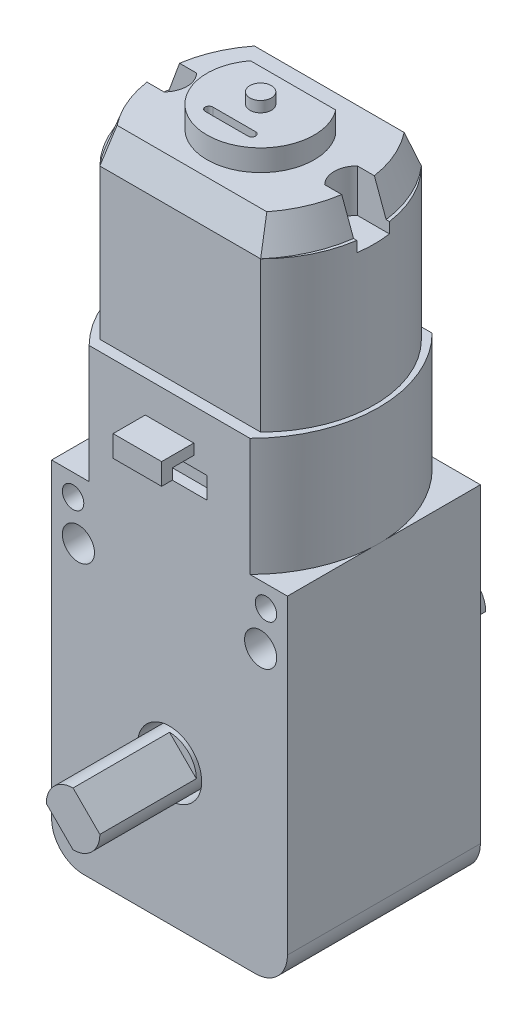
from build123d import *

# Parameters (mm, degrees)
EXTRUDE_1_DEPTH      = 18
EXTRUDE_2_DEPTH      = 11
SKETCH_3_R           = 1
SKETCH_3_R_2         = 1.5
CUT_EXTRUDE_1_DEPTH  = 31
SKETCH_4_R           = 3
CUT_EXTRUDE_2_DEPTH  = 7
CUT_EXTRUDE_START    = -7
SKETCH_5_R           = 3
CUT_EXTRUDE_3_DEPTH  = 7
SKETCH_6_R           = 2.5
EXTRUDE_3_DEPTH      = 16
CUT_EXTRUDE_START_2  = -9
CUT_EXTRUDE_4_DEPTH  = 9
EXTRUDE_START        = 16
SKETCH_8_R           = 2.5
EXTRUDE_4_DEPTH      = 16
CUT_EXTRUDE_5_DEPTH  = 9
EXTRUDE_5_DEPTH      = 5
SKETCH_11_R          = 1
CUT_EXTRUDE_6_DEPTH  = 14
SKETCH_12_R          = 2
EXTRUDE_6_DEPTH      = 2
SKETCH_13_R          = 2
CUT_EXTRUDE_7_DEPTH  = 5
EXTRUDE_START_2      = 3
SKETCH_14_R          = 1.4
EXTRUDE_8_DEPTH      = 3
CUT_EXTRUDE_8_DEPTH  = 22
CUT_EXTRUDE_9_DEPTH  = 11
SKETCH_18_W          = 4.5245364
SKETCH_18_H          = 2
EXTRUDE_9_DEPTH      = 3
SKETCH_19_W          = 2
SKETCH_19_H          = 1
CUT_EXTRUDE_10_DEPTH = 8
SKETCH_20_W          = 2
SKETCH_20_H          = 1
CUT_EXTRUDE_11_DEPTH = 8
EXTRUDE_START_3      = 25
EXTRUDE_10_DEPTH     = 25
CUT_EXTRUDE_13_DEPTH = 1
EXTRUDE_11_DEPTH     = 3
EXTRUDE_11_DRAFT     = 20
SKETCH_25_R          = 5
EXTRUDE_12_DEPTH     = 2
CUT_EXTRUDE_START_3  = -2
CUT_EXTRUDE_14_DEPTH = 2
CUT_EXTRUDE_START_4  = -14
CUT_EXTRUDE_15_DEPTH = 14
CUT_EXTRUDE_16_DEPTH = 14
SKETCH_32_R          = 1
EXTRUDE_13_DEPTH     = 1


with BuildPart() as part:
    # 草图1 → 凸台-拉伸1 (new body)
    with BuildSketch(Plane.XY):
        with BuildLine():
            Line((0, 0), (-8, 0))
            ThreePointArc((-8, 0), (-10.121320344, 0.878679656), (-11, 3))
            Line((-11, 3), (-11, 32))
            Line((-11, 32), (11, 32))
            Line((11, 32), (11, 3))
            ThreePointArc((11, 3), (10.121320344, 0.878679656), (8, 0))
            Line((8, 0), (0, 0))
        make_face()
    extrude(amount=EXTRUDE_1_DEPTH)

    # 草图2 → 凸台-拉伸2 (add)
    with BuildSketch(Plane(origin=(0, 32, 0), x_dir=(1, 0, 0), z_dir=(0, 1, 0))):
        with BuildLine():
            Line((7.5, -18), (-7.5, -18))
            ThreePointArc((-7.5, -18), (-11.02081528, -9.5), (-7.5, -1))
            Line((-7.5, -1), (0, -1))
            Line((0, -1), (7.5, -1))
            ThreePointArc((7.5, -1), (11.02081528, -9.5), (7.5, -18))
        make_face()
    extrude(amount=EXTRUDE_2_DEPTH)

    # 草图3 → 切除-拉伸1 (cut)
    with BuildSketch(Plane.XY.offset(18)):
        with Locations((9, 30)):
            Circle(SKETCH_3_R)
        with Locations((8.5, 26.5)):
            Circle(SKETCH_3_R_2)
        with Locations((-8.5, 26.5)):
            Circle(SKETCH_3_R_2)
        with Locations((-9, 30)):
            Circle(SKETCH_3_R)
    extrude(amount=-CUT_EXTRUDE_1_DEPTH, mode=Mode.SUBTRACT)

    # 草图4 → 切除-拉伸2 (cut)
    with BuildSketch(Plane.XY.offset(18)):
        with Locations((0, 13)):
            Circle(SKETCH_4_R)
    extrude(amount=-CUT_EXTRUDE_2_DEPTH, mode=Mode.SUBTRACT)

    # 草图5 → 切除-拉伸3 (cut)
    with BuildSketch(Plane(origin=(0, 0, 0), x_dir=(-1, 0, 0), z_dir=(0, 0, -1)).offset(CUT_EXTRUDE_START)):
        with Locations(Location((0, 13, 0), (0, 0, 180))):
            Circle(SKETCH_5_R)
    extrude(amount=CUT_EXTRUDE_3_DEPTH, mode=Mode.SUBTRACT)

    # 草图6 → 凸台-拉伸3 (add)
    with BuildSketch(Plane.XY.offset(11)):
        with Locations((0, 13)):
            Circle(SKETCH_6_R)
    extrude(amount=EXTRUDE_3_DEPTH)

    # 草图7 → 切除-拉伸4 (cut)
    with BuildSketch(Plane.XY.offset(27).offset(CUT_EXTRUDE_START_2)):
        with BuildLine():
            Line((0, 15.5), (2.5, 13))
            ThreePointArc((2.5, 13), (1.767766953, 14.767766953), (0, 15.5))
        make_face()
        with BuildLine():
            Line((-2.5, 13), (0, 10.5))
            ThreePointArc((0, 10.5), (-1.767766953, 11.232233047), (-2.5, 13))
        make_face()
    extrude(amount=CUT_EXTRUDE_4_DEPTH, mode=Mode.SUBTRACT)

    # 草图8 → 凸台-拉伸4 (add)
    with BuildSketch(Plane(origin=(0, 0, 7), x_dir=(-1, 0, 0), z_dir=(0, 0, -1)).offset(EXTRUDE_START)):
        with Locations(Location((0, 13, 0), (0, 0, 180))):
            Circle(SKETCH_8_R)
    extrude(amount=-EXTRUDE_4_DEPTH)

    # 草图9 → 切除-拉伸5 (cut)
    with BuildSketch(Plane(origin=(0, 0, -9), x_dir=(-1, 0, 0), z_dir=(0, 0, -1))):
        with BuildLine():
            Line((0, 15.5), (2.5, 13))
            ThreePointArc((2.5, 13), (1.767766953, 14.767766953), (0, 15.5))
        make_face()
        with BuildLine():
            Line((-2.5, 13), (0, 10.5))
            ThreePointArc((0, 10.5), (-1.767766953, 11.232233047), (-2.5, 13))
        make_face()
    extrude(amount=-CUT_EXTRUDE_5_DEPTH, mode=Mode.SUBTRACT)

    # 草图10 → 凸台-拉伸5 (add)
    with BuildSketch(Plane.XZ):
        Polygon((-2.5, 9), (-2.5, 10.5), (2.5, 10.5), (2.5, 7.5), (-2.5, 7.5), align=None)
    extrude(amount=EXTRUDE_5_DEPTH)

    # 草图11 → 切除-拉伸6 (cut)
    with BuildSketch(Plane.XY.offset(10.5)):
        with Locations((0, -2.5)):
            Circle(SKETCH_11_R)
    extrude(amount=-CUT_EXTRUDE_6_DEPTH, mode=Mode.SUBTRACT)

    # 草图12 → 凸台-拉伸6 (add)
    with BuildSketch(Plane(origin=(0, 0, 0), x_dir=(-1, 0, 0), z_dir=(0, 0, -1))):
        with Locations(Location((0, 22, 0), (0, 0, 180))):
            Circle(SKETCH_12_R)
    extrude(amount=EXTRUDE_6_DEPTH)

    # 草图13 → 切除-拉伸7 (cut)
    with BuildSketch(Plane(origin=(0, 0, 0), x_dir=(-1, 0, 0), z_dir=(0, 0, -1))):
        with Locations((-6.646802627, 28.881218783)):
            Circle(SKETCH_13_R)
        with Locations((6.646802627, 28.881218783)):
            Circle(SKETCH_13_R)
    extrude(amount=-CUT_EXTRUDE_7_DEPTH, mode=Mode.SUBTRACT)

    # 草图14 → 凸台-拉伸8 (add)
    # profile 1 of 2: a face of its own
    with BuildSketch(Plane(origin=(0, 0, 5), x_dir=(-1, 0, 0), z_dir=(0, 0, -1)).offset(EXTRUDE_START_2)):
        with BuildLine():
            ThreePointArc((-8.638081379, 29.067790307), (-8.61386249, 28.519728121), (-8.441642649, 27.998864377))
            ThreePointArc((-8.441642649, 27.998864377), (-7.578736532, 27.683754038), (-7.061366244, 26.924656234))
            ThreePointArc((-7.061366244, 26.924656234), (-4.726868568, 29.441444815), (-8.048546627, 30.307792916))
            ThreePointArc((-8.048546627, 30.307792916), (-8.096873145, 29.570626173), (-8.638081379, 29.067790307))
        make_face()
        with Locations((-6.646802627, 28.881218783)):
            Circle(SKETCH_14_R, mode=Mode.SUBTRACT)
    # profile 2 of 2: a face of its own
    with BuildSketch(Plane(origin=(0, 0, 5), x_dir=(-1, 0, 0), z_dir=(0, 0, -1)).offset(EXTRUDE_START_2)):
        with BuildLine():
            ThreePointArc((7.061366244, 26.924656234), (4.726868568, 29.441444815), (8.048546627, 30.307792916))
            ThreePointArc((8.048546627, 30.307792916), (8.096873145, 29.570626173), (8.638081379, 29.067790307))
            ThreePointArc((8.638081379, 29.067790307), (8.61386249, 28.519728121), (8.441642649, 27.998864377))
            ThreePointArc((8.441642649, 27.998864377), (7.578736532, 27.683754038), (7.061366244, 26.924656234))
        make_face()
        with Locations(Location((6.646802627, 28.881218783, 0), (0, 0, 180))):
            Circle(SKETCH_14_R, mode=Mode.SUBTRACT)
    extrude(amount=-EXTRUDE_8_DEPTH)

    # 草图16 → 切除-拉伸8 (cut)
    with BuildSketch(Plane(origin=(0, 0, 1), x_dir=(-1, 0, 0), z_dir=(0, 0, -1))):
        Polygon((0, 36), (3.5, 36), (3.5, 38), (-3.5, 38), (-3.5, 36), align=None)
    extrude(amount=-CUT_EXTRUDE_8_DEPTH, mode=Mode.SUBTRACT)

    # 草图17 → 切除-拉伸9 (cut)
    with BuildSketch(Plane(origin=(0, 43, 0), x_dir=(1, 0, 0), z_dir=(0, 1, 0))):
        with BuildLine():
            Line((7.5, -2), (-7.5, -2))
            ThreePointArc((-7.5, -2), (-10.606601718, -9.5), (-7.5, -17))
            Line((-7.5, -17), (7.5, -17))
            ThreePointArc((7.5, -17), (10.606601718, -9.5), (7.5, -2))
        make_face()
    extrude(amount=-CUT_EXTRUDE_9_DEPTH, mode=Mode.SUBTRACT)

    # 草图18 → 凸台-拉伸9 (add)
    with BuildSketch(Plane(origin=(0, 0, 1), x_dir=(-1, 0, 0), z_dir=(0, 0, -1))):
        with Locations((0, 39)):
            Rectangle(SKETCH_18_W, SKETCH_18_H)
    extrude_9 = extrude(amount=EXTRUDE_9_DEPTH)

    # 草图19 → 切除-拉伸10 (cut)
    with BuildSketch(Plane(origin=(2.2622682, 0, 0), x_dir=(0, 0, -1), z_dir=(1, 0, 0))):
        with Locations((0, 38.5)):
            Rectangle(SKETCH_19_W, SKETCH_19_H)
    extrude(amount=-CUT_EXTRUDE_10_DEPTH, mode=Mode.SUBTRACT)

    # 镜向2: 凸台-拉伸9 across plane
    add(extrude_9.mirror(Plane.XY.offset(9.5)))

    # 草图20 → 切除-拉伸11 (cut)
    with BuildSketch(Plane.ZY.offset(2.2622682)):
        with Locations((19, 38.5)):
            Rectangle(SKETCH_20_W, SKETCH_20_H)
    extrude(amount=-CUT_EXTRUDE_11_DEPTH, mode=Mode.SUBTRACT)

    # 草图21 → 凸台-拉伸10 (add)
    with BuildSketch(Plane(origin=(0, 32, 0), x_dir=(1, 0, 0), z_dir=(0, 1, 0)).offset(EXTRUDE_START_3)):
        with BuildLine():
            Line((7.5, -2), (-7.5, -2))
            ThreePointArc((-7.5, -2), (-10.606601718, -9.5), (-7.5, -17))
            Line((-7.5, -17), (7.5, -17))
            ThreePointArc((7.5, -17), (10.606601718, -9.5), (7.5, -2))
        make_face()
    extrude(amount=-EXTRUDE_10_DEPTH)

    # 草图23 → 切除-拉伸13 (cut)
    with BuildSketch(Plane(origin=(0, 57, 0), x_dir=(1, 0, 0), z_dir=(0, 1, 0))):
        with BuildLine():
            Line((-10.496934744, -7.978697601), (-7.496934744, -7.978697601))
            ThreePointArc((-7.496934744, -7.978697601), (-6.866790657, -9.5), (-7.496934744, -11.021302399))
            Line((-7.496934744, -11.021302399), (-10.496934744, -11.021302399))
            ThreePointArc((-10.496934744, -11.021302399), (-10.606601718, -9.5), (-10.496934744, -7.978697601))
        make_face()
        with BuildLine():
            Line((7.496934744, -11.021302399), (10.496934744, -11.021302399))
            ThreePointArc((10.496934744, -11.021302399), (10.606601718, -9.5), (10.496934744, -7.978697601))
            Line((10.496934744, -7.978697601), (7.496934744, -7.978697601))
            ThreePointArc((7.496934744, -7.978697601), (6.866790657, -9.5), (7.496934744, -11.021302399))
        make_face()
    extrude(amount=-CUT_EXTRUDE_13_DEPTH, mode=Mode.SUBTRACT)


with BuildPart() as extrude_11_tool:
    # 草图24 → 凸台-拉伸11 (with draft: the straight prism first)
    with BuildSketch(Plane(origin=(0, 57, 0), x_dir=(1, 0, 0), z_dir=(0, 1, 0))):
        with BuildLine():
            Line((7.5, -2), (-7.5, -2))
            ThreePointArc((-7.5, -2), (-10.289850602, -9.5), (-7.5, -17))
            Line((-7.5, -17), (7.5, -17))
            ThreePointArc((7.5, -17), (10.289850602, -9.5), (7.5, -2))
        make_face()
    extrude(amount=EXTRUDE_11_DEPTH)
    # 凸台-拉伸11: the draft: its side faces are tilted about the plane it starts from
    extrude_11_sides = [extrude_11_tool.faces().sort_by_distance(p)[0] for p in [
        (0, 58.5, 2),
        (-10.289850602, 58.5, 9.5),
        (0, 58.5, 17),
        (10.289850602, 58.5, 9.5),
    ]]
    draft(extrude_11_sides, Plane(origin=(0, 57, 0), x_dir=(1, 0, 0), z_dir=(0, 1, 0)), EXTRUDE_11_DRAFT)


with BuildPart() as part_1:
    add(part.part)

    # 凸台-拉伸11: add extrude_11_tool
    add(extrude_11_tool.part)

    # 草图25 → 凸台-拉伸12 (add)
    with BuildSketch(Plane(origin=(0, 60, 0), x_dir=(1, 0, 0), z_dir=(0, 1, 0))):
        with Locations(Location((0, -9.5, 0), (0, 0, 90))):
            Circle(SKETCH_25_R)
    extrude(amount=EXTRUDE_12_DEPTH)

    # 草图26 → 切除-拉伸14 (cut)
    with BuildSketch(Plane(origin=(0, 62, 0), x_dir=(1, 0, 0), z_dir=(0, 1, 0)).offset(CUT_EXTRUDE_START_3)):
        with BuildLine():
            Line((3.977952818, -6.470826618), (-3.977952818, -6.470826618))
            ThreePointArc((-3.977952818, -6.470826618), (0, -4.5), (3.977952818, -6.470826618))
        make_face()
    extrude(amount=CUT_EXTRUDE_14_DEPTH, mode=Mode.SUBTRACT)

    # 草图30 → 切除-拉伸15 (cut)
    with BuildSketch(Plane.XZ.offset(-57).offset(CUT_EXTRUDE_START_4)):
        with BuildLine():
            Line((7.496934744, 7.978697601), (10.496934744, 7.978697601))
            Line((10.496934744, 7.978697601), (10.496934744, 11.021302399))
            Line((10.496934744, 11.021302399), (7.496934744, 11.021302399))
            ThreePointArc((7.496934744, 11.021302399), (6.866790657, 9.5), (7.496934744, 7.978697601))
        make_face()
        with BuildLine():
            Line((-10.496934744, 11.021302399), (-7.496934744, 11.021302399))
            ThreePointArc((-7.496934744, 11.021302399), (-6.866790657, 9.5), (-7.496934744, 7.978697601))
            Line((-7.496934744, 7.978697601), (-10.496934744, 7.978697601))
            Line((-10.496934744, 7.978697601), (-10.496934744, 11.021302399))
        make_face()
    extrude(amount=CUT_EXTRUDE_15_DEPTH, mode=Mode.SUBTRACT)

    # 草图31 → 切除-拉伸16 (cut)
    with BuildSketch(Plane(origin=(0, 62, 0), x_dir=(1, 0, 0), z_dir=(0, 1, 0))):
        with BuildLine():
            Line((2, -12.67407861), (-2, -12.67407861))
            ThreePointArc((-2, -12.67407861), (-2.354738624, -12.319339986), (-2, -11.964601361))
            Line((-2, -11.964601361), (2, -11.964601361))
            ThreePointArc((2, -11.964601361), (2.354738624, -12.319339986), (2, -12.67407861))
        make_face()
    extrude(amount=-CUT_EXTRUDE_16_DEPTH, mode=Mode.SUBTRACT)

    # 草图32 → 凸台-拉伸13 (add)
    with BuildSketch(Plane(origin=(0, 62, 0), x_dir=(1, 0, 0), z_dir=(0, 1, 0))):
        with Locations(Location((0, -9.5, 0), (0, 0, 90))):
            Circle(SKETCH_32_R)
    extrude(amount=EXTRUDE_13_DEPTH)


solid = part_1.part
